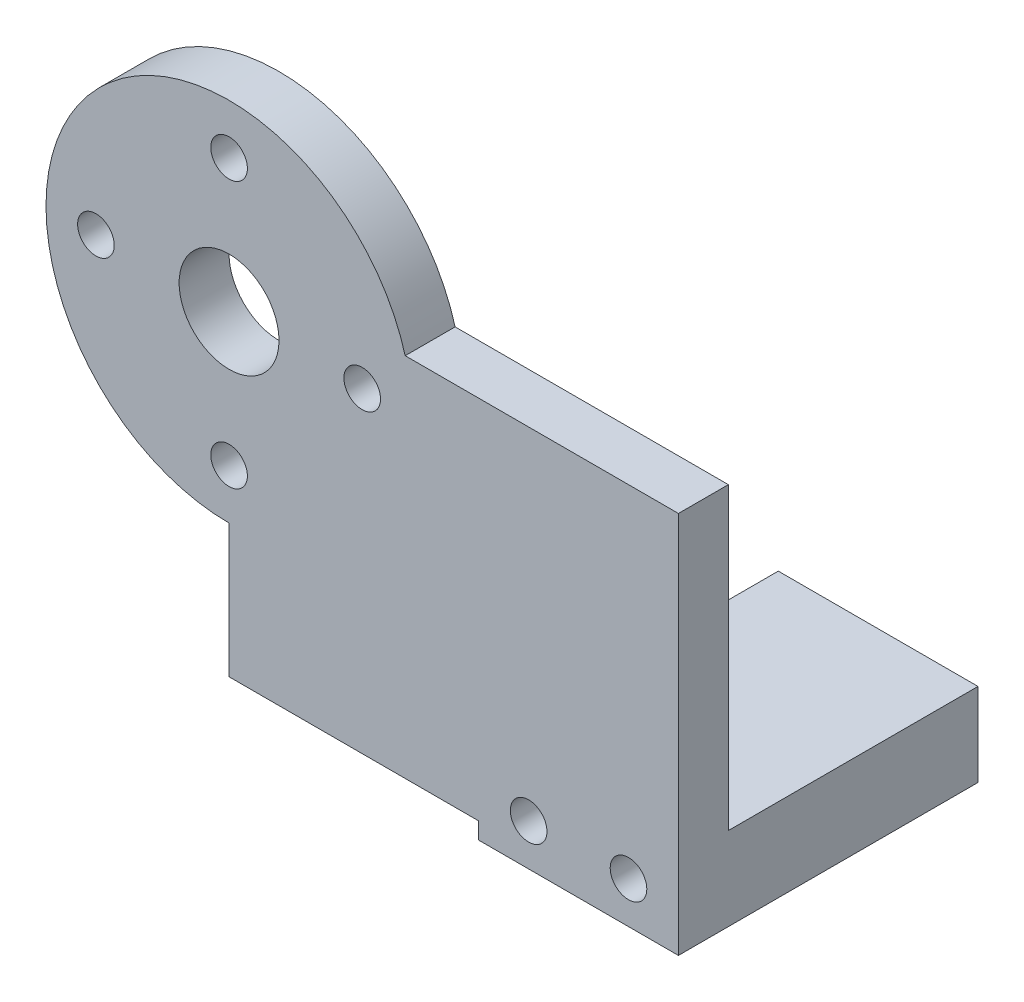
from build123d import *

# Parameters (mm, degrees)
STOCK_HORN_ATTACHMENT_START         = 15
STOCK_HORN_ATTACHMENT_PROFILE_R     = 11
STOCK_HORN_ATTACHMENT_DEPTH         = 3
FINGER_ARM_START                    = 15
FINGER_ARM_PROFILE_W                = 27
FINGER_ARM_PROFILE_H                = 22
FINGER_ARM_DEPTH                    = 3
DESCENDING_CONTACT_FINGER_PROFILE_W = 12
DESCENDING_CONTACT_FINGER_PROFILE_H = 5
DESCENDING_CONTACT_FINGER_DEPTH     = 18
HORN_CENTER_ACCESS_START            = -50
HORN_CENTER_ACCESS_PROFILE_R        = 3
HORN_CENTER_ACCESS_DEPTH            = 89.118237105
HORN_SCREWS_START                   = -50
HORN_SCREWS_PROFILE_R               = 1.1
HORN_SCREWS_DEPTH                   = 89.118237105
CONTACT_PAD_KEEPER_START            = -50
CONTACT_PAD_KEEPER_PROFILE_R        = 1.1
CONTACT_PAD_KEEPER_DEPTH            = 89.118237105


with BuildPart() as part:
    # Stock_horn_attachment_profile → Stock_horn_attachment (new body)
    with BuildSketch(Plane.XY.offset(STOCK_HORN_ATTACHMENT_START)):
        Circle(STOCK_HORN_ATTACHMENT_PROFILE_R)
    extrude(amount=STOCK_HORN_ATTACHMENT_DEPTH)

    # Finger_arm_profile → Finger_arm (add)
    with BuildSketch(Plane.XY.offset(FINGER_ARM_START)):
        with Locations((13.5, -8)):
            Rectangle(FINGER_ARM_PROFILE_W, FINGER_ARM_PROFILE_H)
    extrude(amount=FINGER_ARM_DEPTH)

    # Descending_contact_finger_profile → Descending_contact_finger (add)
    with BuildSketch(Plane.XY):
        with Locations((21, -17.5)):
            Rectangle(DESCENDING_CONTACT_FINGER_PROFILE_W, DESCENDING_CONTACT_FINGER_PROFILE_H)
    extrude(amount=DESCENDING_CONTACT_FINGER_DEPTH)

    # Horn_center_access_profile → Horn_center_access (cut, through all)
    with BuildSketch(Plane.XY.offset(HORN_CENTER_ACCESS_START)):
        Circle(HORN_CENTER_ACCESS_PROFILE_R)
    extrude(amount=HORN_CENTER_ACCESS_DEPTH, mode=Mode.SUBTRACT)

    # Horn_screws_profile → Horn_screws (cut, through all)
    with BuildSketch(Plane.XY.offset(HORN_SCREWS_START)):
        with Locations((0, -8)):
            Circle(HORN_SCREWS_PROFILE_R)
        with Locations((0, 8)):
            Circle(HORN_SCREWS_PROFILE_R)
        with Locations((-8, 0)):
            Circle(HORN_SCREWS_PROFILE_R)
        with Locations((8, 0)):
            Circle(HORN_SCREWS_PROFILE_R)
    extrude(amount=HORN_SCREWS_DEPTH, mode=Mode.SUBTRACT)

    # Contact_pad_keeper_profile → Contact_pad_keeper (cut, through all)
    with BuildSketch(Plane.XY.offset(CONTACT_PAD_KEEPER_START)):
        with Locations(Location((18, -17.5, 0), (0, 0, 180))):
            Circle(CONTACT_PAD_KEEPER_PROFILE_R)
        with Locations(Location((24, -17.5, 0), (0, 0, 180))):
            Circle(CONTACT_PAD_KEEPER_PROFILE_R)
    extrude(amount=CONTACT_PAD_KEEPER_DEPTH, mode=Mode.SUBTRACT)


solid = part.part
